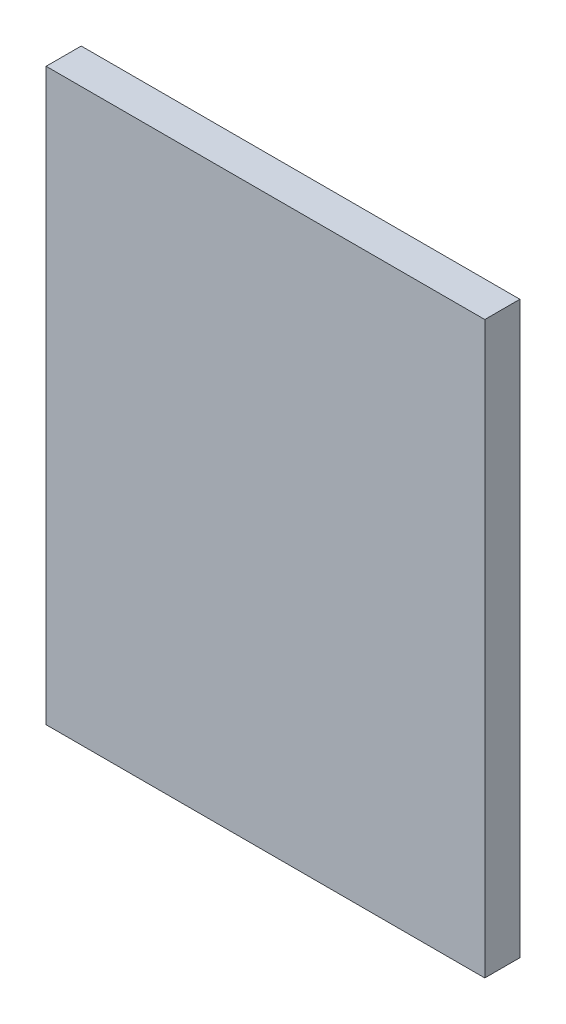
from build123d import *

# Parameters (mm, degrees)
SKETCH1_W           = 100
SKETCH1_H           = 130
BOSS_EXTRUDE1_DEPTH = 8


with BuildPart() as part:
    # Sketch1 → Boss-Extrude1 (new body)
    with BuildSketch(Plane.XY):
        with Locations((50, 65)):
            Rectangle(SKETCH1_W, SKETCH1_H)
    extrude(amount=BOSS_EXTRUDE1_DEPTH)


solid = part.part
